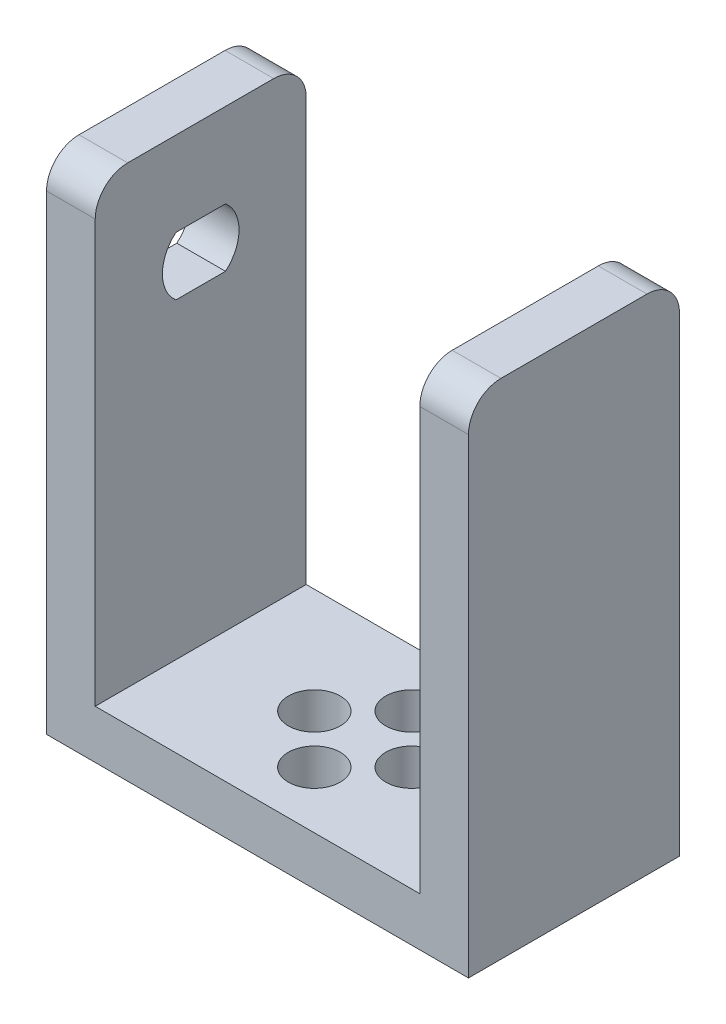
from build123d import *

# Parameters (mm, degrees)
SKETCH_1_W          = 20
SKETCH_1_H          = 13
SKETCH_1_R          = 1.6
EXTRUDE_1_DEPTH     = 3
SKETCH_2_W          = 3
SKETCH_2_H          = 13
EXTRUDE_2_DEPTH     = 31
SKETCH_3_R          = 4.13
CUT_EXTRUDE_1_DEPTH = 1.5
CUT_EXTRUDE_2_DEPTH = 10
FILLET_1_R          = 2


with BuildPart() as part:
    # 草图1 → 凸台-拉伸1 (new body)
    with BuildSketch(Plane(origin=(0, 0, 0), x_dir=(1, 0, 0), z_dir=(0, 1, 0))):
        Rectangle(SKETCH_1_W, SKETCH_1_H)
        with Locations(Location((0, 3, 0), (0, 0, 270))):
            Circle(SKETCH_1_R, mode=Mode.SUBTRACT)
        with Locations(Location((3, 0, 0), (0, 0, 270))):
            Circle(SKETCH_1_R, mode=Mode.SUBTRACT)
        with Locations(Location((0, -3, 0), (0, 0, 90))):
            Circle(SKETCH_1_R, mode=Mode.SUBTRACT)
        with Locations(Location((-3, 0, 0), (0, 0, 90))):
            Circle(SKETCH_1_R, mode=Mode.SUBTRACT)
    extrude(amount=EXTRUDE_1_DEPTH)

    # 草图2 → 凸台-拉伸2 (add)
    with BuildSketch(Plane(origin=(0, 0, 0), x_dir=(1, 0, 0), z_dir=(0, 1, 0))):
        with Locations((11.5, 0)):
            Rectangle(SKETCH_2_W, SKETCH_2_H)
        with Locations((-11.5, 0)):
            Rectangle(SKETCH_2_W, SKETCH_2_H)
    extrude(amount=EXTRUDE_2_DEPTH)

    # 草图3 → 切除-拉伸1 (cut)
    with BuildSketch(Plane.ZY.offset(-10)):
        with Locations((0, 24)):
            Circle(SKETCH_3_R)
    extrude(amount=-CUT_EXTRUDE_1_DEPTH, mode=Mode.SUBTRACT)

    # 草图4 → 切除-拉伸2 (cut)
    with BuildSketch(Plane(origin=(-10, 0, 0), x_dir=(0, 0, -1), z_dir=(1, 0, 0))):
        with BuildLine():
            Line((1.526302722, 25.8), (-1.526302722, 25.8))
            ThreePointArc((-1.526302722, 25.8), (-2.36, 24), (-1.526302722, 22.2))
            Line((-1.526302722, 22.2), (1.526302722, 22.2))
            ThreePointArc((1.526302722, 22.2), (2.36, 24), (1.526302722, 25.8))
        make_face()
    extrude(amount=-CUT_EXTRUDE_2_DEPTH, mode=Mode.SUBTRACT)

    # 圆角1
    fillet_1_edges = [part.edges().sort_by_distance(p)[0] for p in [
        (-11.5, 31, -6.5),
        (-11.5, 31, 6.5),
        (11.5, 31, 6.5),
        (11.5, 31, -6.5),
    ]]
    fillet(fillet_1_edges, radius=FILLET_1_R)


solid = part.part
